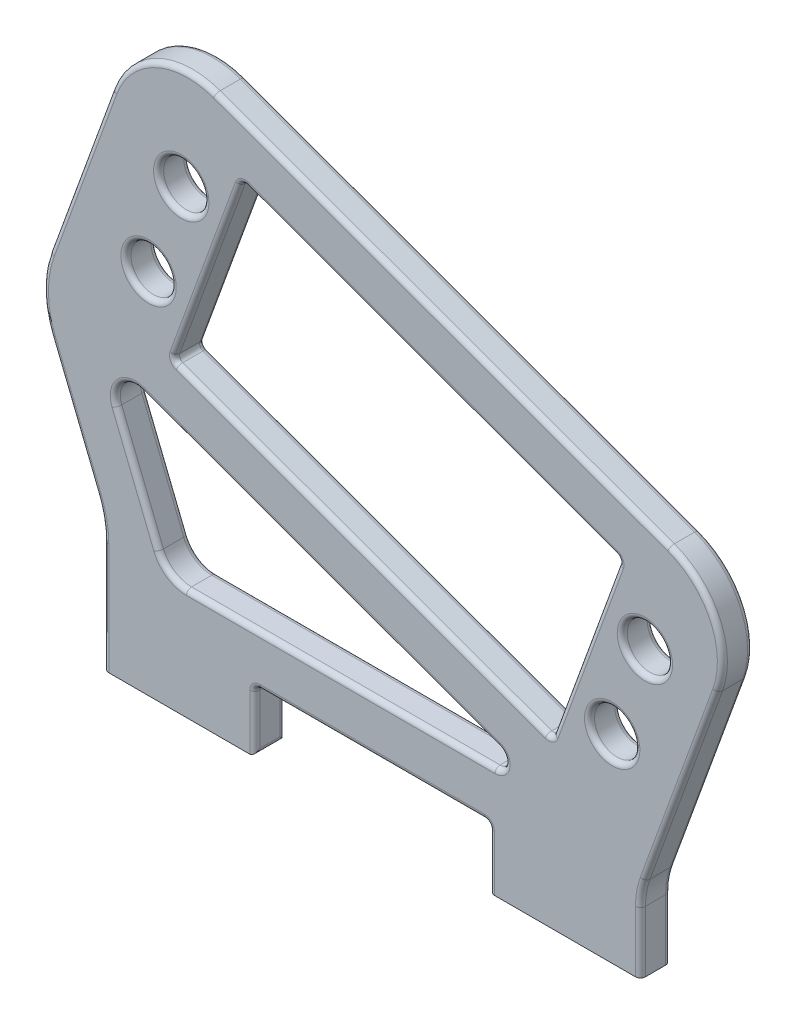
from build123d import *

# Parameters (mm, degrees)
SKETCH1_R           = 2.25
BOSS_EXTRUDE1_DEPTH = 3
FILLET1_R           = 8
FILLET2_R           = 10
FILLET3_R           = 7.5
CUT_EXTRUDE1_DEPTH  = 10
FILLET4_R           = 0.5


with BuildPart() as part:
    # Sketch1 → Boss-Extrude1 (new body)
    with BuildSketch(Plane.XY):
        Polygon((0, 0), (15, 0), (15, 6), (38.3, 6), (38.3, 0), (53.3, 0), (53.3, 7.386691303), (63.695988946, 35.949436184), (3.555661215, 57.838725357), (-6.704943084, 29.647946733), (0, 13), align=None)
        with Locations((7.699052679, 45.422832027)):
            Circle(SKETCH1_R, mode=Mode.SUBTRACT)
        with Locations(Location((4.449861318, 36.495752129, 0), (0, 0, 180))):
            Circle(SKETCH1_R, mode=Mode.SUBTRACT)
        with Locations(Location((53.743991098, 28.663845004, 0), (0, 0, 180))):
            Circle(SKETCH1_R, mode=Mode.SUBTRACT)
        with Locations((50.494799736, 19.736765107)):
            Circle(SKETCH1_R, mode=Mode.SUBTRACT)
        Polygon((6.882872359, 30.023275225), (13.723275225, 48.817127641), (51.310980057, 35.136321908), (44.47057719, 16.342469492), align=None, mode=Mode.SUBTRACT)
    extrude(amount=BOSS_EXTRUDE1_DEPTH)

    # Fillet1
    fillet1_edges = [part.edges().sort_by_distance(p)[0] for p in [
        (3.555661215, 57.838725357, 1.5),
        (63.695988946, 35.949436184, 1.5),
    ]]
    fillet(fillet1_edges, radius=FILLET1_R)

    # Fillet2
    fillet2_edges = [part.edges().sort_by_distance(p)[0] for p in [
        (0, 13, 1.5),
        (-6.704943084, 29.647946733, 1.5),
    ]]
    fillet(fillet2_edges, radius=FILLET2_R)

    # Fillet3
    fillet3_edges = [part.edges().sort_by_distance(p)[0] for p in [
        (53.3, 7.386691303, 1.5),
    ]]
    fillet(fillet3_edges, radius=FILLET3_R)

    # Sketch3 → Cut-Extrude1 (cut)
    with BuildSketch(Plane.XY.offset(3)):
        with BuildLine():
            Line((8.22170639, 11), (38.858587664, 11))
            ThreePointArc((38.858587664, 11), (39.843395417, 11.826351822), (39.200607808, 12.939692621))
            Line((39.200607808, 12.939692621), (3.826155353, 25.814940368))
            ThreePointArc((3.826155353, 25.814940368), (1.70419878, 25.325661868), (1.28692545, 23.188379454))
            Line((1.28692545, 23.188379454), (5.438921964, 12.879236492))
            ThreePointArc((5.438921964, 12.879236492), (6.542761859, 11.513809086), (8.22170639, 11))
        make_face()
    extrude(amount=-CUT_EXTRUDE1_DEPTH, mode=Mode.SUBTRACT)

    # Fillet4
    fillet4_edges = [part.edges().sort_by_distance(p)[0] for p in [
        (15, 3, 3),
        (39.843395417, 11.826351822, 3),
        (21.51338158, 19.377316494, 3),
        (1.70419878, 25.325661868, 3),
        (3.362923707, 18.033807973, 3),
        (6.542761859, 11.513809086, 3),
        (23.540147027, 11, 3),
        (53.3, 3.032119474, 0),
        (38.3, 3, 0),
        (26.65, 6, 0),
        (26.65, 6, 3),
        (15, 3, 0),
        (38.3, 3, 3),
        (38.3, 0, 1.5),
        (38.3, 6, 1.5),
        (15, 6, 1.5),
        (15, 0, 1.5),
        (53.3, 3.032119474, 3),
        (25.676724775, 23.182872359, 0),
        (6.882872359, 30.023275225, 1.5),
        (47.890778624, 25.7393957, 0),
        (44.47057719, 16.342469492, 1.5),
        (32.517127641, 41.976724775, 0),
        (51.310980057, 35.136321908, 1.5),
        (10.303073792, 39.420201433, 0),
        (13.723275225, 48.817127641, 1.5),
        (25.676724775, 23.182872359, 3),
        (47.890778624, 25.7393957, 3),
        (32.517127641, 41.976724775, 3),
        (10.303073792, 39.420201433, 3),
        (5.449052679, 45.422832027, 0),
        (5.449052679, 45.422832027, 3),
        (6.699861318, 36.495752129, 0),
        (6.699861318, 36.495752129, 3),
        (55.993991098, 28.663845004, 0),
        (55.993991098, 28.663845004, 3),
        (48.244799736, 19.736765107, 0),
        (48.244799736, 19.736765107, 3),
        (33.62582508, 46.89408077, 0),
        (33.62582508, 46.89408077, 3),
        (-2.287352817, 41.785176242, 0),
        (4.956094941, 54.83548554, 0),
        (60.692749129, 34.549002458, 0),
        (-2.287352817, 41.785176242, 3),
        (4.956094941, 54.83548554, 3),
        (60.692749129, 34.549002458, 3),
        (0, 5.53094822, 0),
        (0, 5.53094822, 3),
        (-2.998639747, 20.44543155, 0),
        (-2.998639747, 20.44543155, 3),
        (-5.995850797, 29.659934393, 0),
        (-5.995850797, 29.659934393, 3),
        (-0.182681607, 12.964594413, 0),
        (-0.182681607, 12.964594413, 3),
        (57.356066572, 18.53064262, 0),
        (57.356066572, 18.53064262, 3),
        (53.413941852, 7.36660028, 0),
        (53.413941852, 7.36660028, 3),
        (21.51338158, 19.377316494, 0),
        (1.70419878, 25.325661868, 0),
        (3.362923707, 18.033807973, 0),
        (6.542761859, 11.513809086, 0),
        (23.540147027, 11, 0),
        (39.843395417, 11.826351822, 0),
    ]]
    fillet(fillet4_edges, radius=FILLET4_R)


solid = part.part
